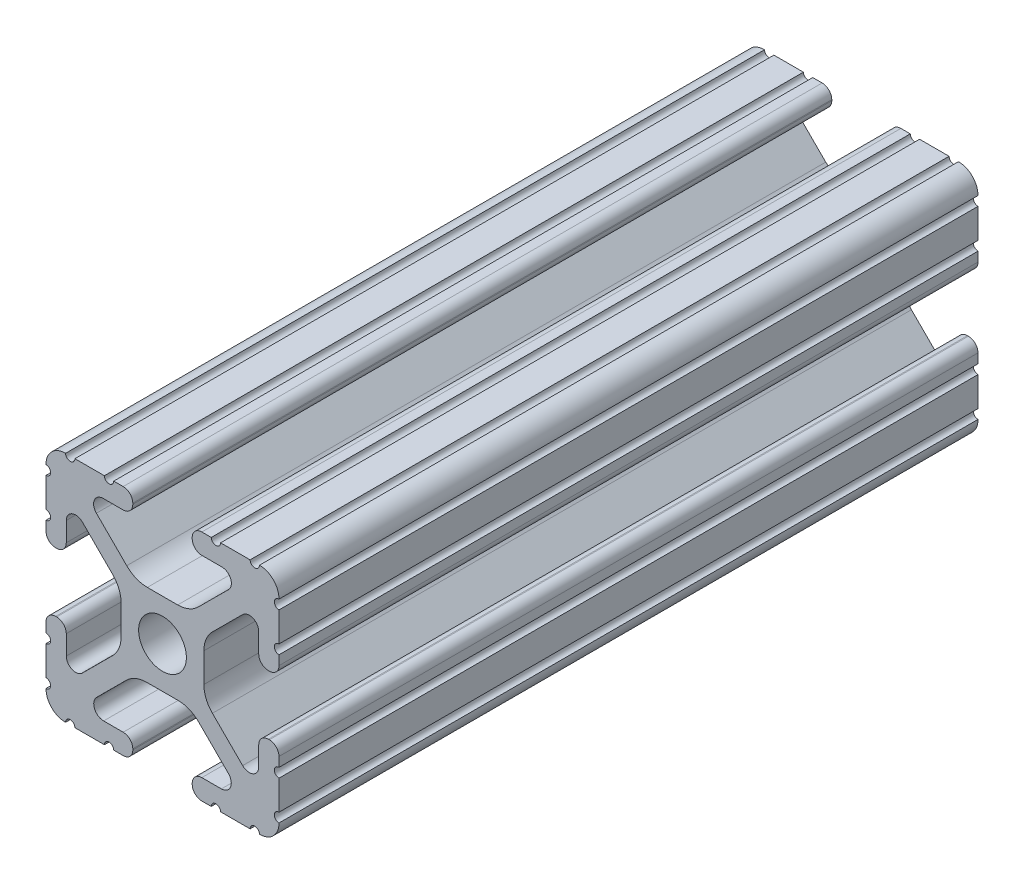
from build123d import *

# Parameters (mm, degrees)
SKETCH1_R           = 2.6035
BOSS_EXTRUDE1_DEPTH = 38.1


with BuildPart() as part:
    # Sketch1 → Boss-Extrude1 (new, symmetric)
    with BuildSketch(Plane.XY):
        with BuildLine():
            Line((-7.179650497, -8.645192506), (-3.952270251, -5.423690499))
            ThreePointArc((-3.952270251, -5.423690499), (-2.922936451, -4.736929036), (-1.709253557, -4.4958))
            Line((-1.709253557, -4.4958), (1.709253557, -4.4958))
            ThreePointArc((1.709253557, -4.4958), (2.922936451, -4.736929036), (3.952270251, -5.423690499))
            Line((3.952270251, -5.423690499), (7.179650497, -8.645192506))
            ThreePointArc((7.179650497, -8.645192506), (7.41473083, -9.822813117), (6.416408329, -10.4902))
            Line((6.416408329, -10.4902), (4.287512407, -10.4902))
            ThreePointArc((4.287512407, -10.4902), (3.54574862, -10.79744862), (3.2385, -11.539212407))
            Line((3.2385, -11.539212407), (3.2385, -11.650987593))
            ThreePointArc((3.2385, -11.650987593), (3.54574862, -12.39275138), (4.287512407, -12.7))
            Line((4.287512407, -12.7), (5.317126718, -12.7))
            ThreePointArc((5.317126718, -12.7), (5.825126718, -12.192), (6.333126718, -12.7))
            Line((6.333126718, -12.7), (9.550443118, -12.7))
            ThreePointArc((9.550443118, -12.7), (10.058366869, -12.192000006), (10.566443095, -12.699847501))
            ThreePointArc((10.566443095, -12.699847501), (12.082537762, -12.08250727), (12.699846982, -10.566399977))
            ThreePointArc((12.699846982, -10.566399977), (12.192000006, -10.058323491), (12.7, -9.5504))
            Line((12.7, -9.5504), (12.7, -6.3330836))
            ThreePointArc((12.7, -6.3330836), (12.192, -5.8250836), (12.7, -5.3170836))
            Line((12.7, -5.3170836), (12.7, -4.287469289))
            ThreePointArc((12.7, -4.287469289), (12.39275138, -3.545705502), (11.650987593, -3.238456882))
            Line((11.650987593, -3.238456882), (11.539212407, -3.238456882))
            ThreePointArc((11.539212407, -3.238456882), (10.79744862, -3.545705502), (10.4902, -4.287469289))
            Line((10.4902, -4.287469289), (10.4902, -6.402089023))
            ThreePointArc((10.4902, -6.402089023), (9.856505071, -7.351067942), (8.737131347, -7.129408934))
            Line((8.737131347, -7.129408934), (5.441005833, -3.840816462))
            ThreePointArc((5.441005833, -3.840816462), (4.750877967, -2.809883091), (4.5085, -1.593185507))
            Line((4.5085, -1.593185507), (4.5085, 1.593185507))
            ThreePointArc((4.5085, 1.593185507), (4.750877967, 2.809883091), (5.441005833, 3.840816462))
            Line((5.441005833, 3.840816462), (8.737131347, 7.129408934))
            ThreePointArc((8.737131347, 7.129408934), (9.856505071, 7.351067942), (10.4902, 6.402089023))
            Line((10.4902, 6.402089023), (10.4902, 4.287469289))
            ThreePointArc((10.4902, 4.287469289), (10.79744862, 3.545705502), (11.539212407, 3.238456882))
            Line((11.539212407, 3.238456882), (11.650987593, 3.238456882))
            ThreePointArc((11.650987593, 3.238456882), (12.39275138, 3.545705502), (12.7, 4.287469289))
            Line((12.7, 4.287469289), (12.7, 5.3170836))
            ThreePointArc((12.7, 5.3170836), (12.192, 5.8250836), (12.7, 6.3330836))
            Line((12.7, 6.3330836), (12.7, 9.5504))
            ThreePointArc((12.7, 9.5504), (12.192000006, 10.058323491), (12.699846982, 10.566399977))
            ThreePointArc((12.699846982, 10.566399977), (12.082537762, 12.08250727), (10.566443095, 12.699847501))
            ThreePointArc((10.566443095, 12.699847501), (10.058366869, 12.192000006), (9.550443118, 12.7))
            Line((9.550443118, 12.7), (6.333126718, 12.7))
            ThreePointArc((6.333126718, 12.7), (5.825126718, 12.192), (5.317126718, 12.7))
            Line((5.317126718, 12.7), (4.287512407, 12.7))
            ThreePointArc((4.287512407, 12.7), (3.54574862, 12.39275138), (3.2385, 11.650987593))
            Line((3.2385, 11.650987593), (3.2385, 11.539212407))
            ThreePointArc((3.2385, 11.539212407), (3.54574862, 10.79744862), (4.287512407, 10.4902))
            Line((4.287512407, 10.4902), (6.476788598, 10.4902))
            ThreePointArc((6.476788598, 10.4902), (7.432222385, 9.85140422), (7.207036008, 8.724370562))
            Line((7.207036008, 8.724370562), (3.898272566, 5.423169045))
            ThreePointArc((3.898272566, 5.423169045), (2.869120213, 4.736787962), (1.655778399, 4.4958))
            Line((1.655778399, 4.4958), (-1.655778399, 4.4958))
            ThreePointArc((-1.655778399, 4.4958), (-2.869120213, 4.736787962), (-3.898272566, 5.423169045))
            Line((-3.898272566, 5.423169045), (-7.207036008, 8.724370562))
            ThreePointArc((-7.207036008, 8.724370562), (-7.432222385, 9.85140422), (-6.476788598, 10.4902))
            Line((-6.476788598, 10.4902), (-4.287512407, 10.4902))
            ThreePointArc((-4.287512407, 10.4902), (-3.54574862, 10.79744862), (-3.2385, 11.539212407))
            Line((-3.2385, 11.539212407), (-3.2385, 11.650987593))
            ThreePointArc((-3.2385, 11.650987593), (-3.54574862, 12.39275138), (-4.287512407, 12.7))
            Line((-4.287512407, 12.7), (-5.317126718, 12.7))
            ThreePointArc((-5.317126718, 12.7), (-5.825126718, 12.192), (-6.333126718, 12.7))
            Line((-6.333126718, 12.7), (-9.550443118, 12.7))
            ThreePointArc((-9.550443118, 12.7), (-10.058366869, 12.192000006), (-10.566443095, 12.699847501))
            ThreePointArc((-10.566443095, 12.699847501), (-12.082537762, 12.08250727), (-12.699846982, 10.566399977))
            ThreePointArc((-12.699846982, 10.566399977), (-12.192000006, 10.058323491), (-12.7, 9.5504))
            Line((-12.7, 9.5504), (-12.7, 6.3330836))
            ThreePointArc((-12.7, 6.3330836), (-12.192, 5.8250836), (-12.7, 5.3170836))
            Line((-12.7, 5.3170836), (-12.7, 4.287469289))
            ThreePointArc((-12.7, 4.287469289), (-12.39275138, 3.545705502), (-11.650987593, 3.238456882))
            Line((-11.650987593, 3.238456882), (-11.539212407, 3.238456882))
            ThreePointArc((-11.539212407, 3.238456882), (-10.79744862, 3.545705502), (-10.4902, 4.287469289))
            Line((-10.4902, 4.287469289), (-10.4902, 6.402089023))
            ThreePointArc((-10.4902, 6.402089023), (-9.856505071, 7.351067942), (-8.737131347, 7.129408934))
            Line((-8.737131347, 7.129408934), (-5.441005833, 3.840816462))
            ThreePointArc((-5.441005833, 3.840816462), (-4.750877967, 2.809883091), (-4.5085, 1.593185507))
            Line((-4.5085, 1.593185507), (-4.5085, -1.593185507))
            ThreePointArc((-4.5085, -1.593185507), (-4.750877967, -2.809883091), (-5.441005833, -3.840816462))
            Line((-5.441005833, -3.840816462), (-8.737131347, -7.129408934))
            ThreePointArc((-8.737131347, -7.129408934), (-9.856505071, -7.351067942), (-10.4902, -6.402089023))
            Line((-10.4902, -6.402089023), (-10.4902, -4.287469289))
            ThreePointArc((-10.4902, -4.287469289), (-10.79744862, -3.545705502), (-11.539212407, -3.238456882))
            Line((-11.539212407, -3.238456882), (-11.650987593, -3.238456882))
            ThreePointArc((-11.650987593, -3.238456882), (-12.39275138, -3.545705502), (-12.7, -4.287469289))
            Line((-12.7, -4.287469289), (-12.7, -5.3170836))
            ThreePointArc((-12.7, -5.3170836), (-12.192, -5.8250836), (-12.7, -6.3330836))
            Line((-12.7, -6.3330836), (-12.7, -9.5504))
            ThreePointArc((-12.7, -9.5504), (-12.192000006, -10.058323491), (-12.699846982, -10.566399977))
            ThreePointArc((-12.699846982, -10.566399977), (-12.082537762, -12.08250727), (-10.566443095, -12.699847501))
            ThreePointArc((-10.566443095, -12.699847501), (-10.058366869, -12.192000006), (-9.550443118, -12.7))
            Line((-9.550443118, -12.7), (-6.333126718, -12.7))
            ThreePointArc((-6.333126718, -12.7), (-5.825126718, -12.192), (-5.317126718, -12.7))
            Line((-5.317126718, -12.7), (-4.287512407, -12.7))
            ThreePointArc((-4.287512407, -12.7), (-3.54574862, -12.39275138), (-3.2385, -11.650987593))
            Line((-3.2385, -11.650987593), (-3.2385, -11.539212407))
            ThreePointArc((-3.2385, -11.539212407), (-3.54574862, -10.79744862), (-4.287512407, -10.4902))
            Line((-4.287512407, -10.4902), (-6.416408329, -10.4902))
            ThreePointArc((-6.416408329, -10.4902), (-7.41473083, -9.822813117), (-7.179650497, -8.645192506))
        make_face()
        with Locations(Location((0, 0, 0), (0, 0, 180))):
            Circle(SKETCH1_R, mode=Mode.SUBTRACT)
    extrude(amount=BOSS_EXTRUDE1_DEPTH, both=True)


solid = part.part
